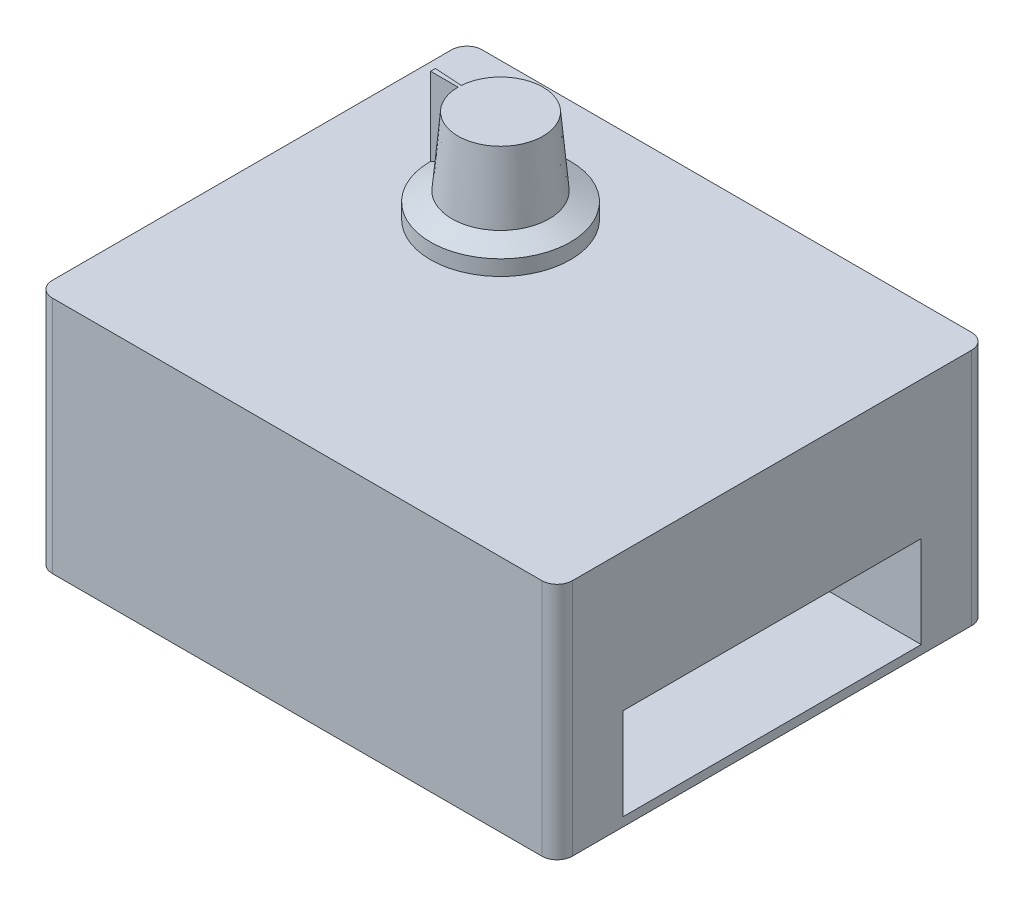
from build123d import *

# Parameters (mm, degrees)
SKETCH1_W           = 86.36
SKETCH1_H           = 71.374
BOSS_EXTRUDE1_DEPTH = 39.624
FILLET1_R           = 2.54
CUT_EXTRUDE1_DEPTH  = 25.4
FILLET2_R           = 1.27
SKETCH4_W           = 49.53
SKETCH4_H           = 15.24
CUT_EXTRUDE2_DEPTH  = 50.8
SKETCH5_R           = 11.6205
BOSS_EXTRUDE2_DEPTH = 15.494
CUT_REVOLVE1_ANGLE  = 356


with BuildPart() as part:
    # Sketch1 → Boss-Extrude1 (new body)
    with BuildSketch(Plane(origin=(0, 0, 0), x_dir=(1, 0, 0), z_dir=(0, 1, 0))):
        with Locations((43.18, -35.687)):
            Rectangle(SKETCH1_W, SKETCH1_H)
    extrude(amount=BOSS_EXTRUDE1_DEPTH)

    # Fillet1
    fillet1_edges = [part.edges().sort_by_distance(p)[0] for p in [
        (0, 19.812, 0),
        (86.36, 19.812, 0),
        (86.36, 19.812, 71.374),
        (0, 19.812, 71.374),
    ]]
    fillet(fillet1_edges, radius=FILLET1_R)

    # Sketch2 → Cut-Extrude1 (cut)
    with BuildSketch(Plane.ZY):
        with BuildLine():
            Line((30.226, 33.02), (30.48, 33.02))
            ThreePointArc((30.48, 33.02), (31.737235857, 32.499235857), (32.258, 31.242))
            Line((32.258, 31.242), (32.258, 24.892))
            ThreePointArc((32.258, 24.892), (31.737235857, 23.634764143), (30.48, 23.114))
            Line((30.48, 23.114), (30.226, 23.114))
            ThreePointArc((30.226, 23.114), (28.968764143, 23.634764143), (28.448, 24.892))
            Line((28.448, 24.892), (28.448, 31.242))
            ThreePointArc((28.448, 31.242), (28.968764143, 32.499235857), (30.226, 33.02))
        make_face()
        with BuildLine():
            Line((41.148, 23.114), (40.894, 23.114))
            ThreePointArc((40.894, 23.114), (39.636764143, 23.634764143), (39.116, 24.892))
            Line((39.116, 24.892), (39.116, 31.242))
            ThreePointArc((39.116, 31.242), (39.636764143, 32.499235857), (40.894, 33.02))
            Line((40.894, 33.02), (41.148, 33.02))
            ThreePointArc((41.148, 33.02), (42.405235857, 32.499235857), (42.926, 31.242))
            Line((42.926, 31.242), (42.926, 24.892))
            ThreePointArc((42.926, 24.892), (42.405235857, 23.634764143), (41.148, 23.114))
        make_face()
    extrude(amount=-CUT_EXTRUDE1_DEPTH, mode=Mode.SUBTRACT)

    # Fillet2
    fillet2_edges = [part.edges().sort_by_distance(p)[0] for p in [
        (0, 23.634764143, 28.968764143),
        (0, 23.114, 30.353),
        (0, 23.634764143, 31.737235857),
        (0, 28.067, 32.258),
        (0, 32.499235857, 31.737235857),
        (0, 33.02, 30.353),
        (0, 32.499235857, 28.968764143),
        (0, 28.067, 28.448),
        (0, 23.634764143, 42.405235857),
        (0, 28.067, 42.926),
        (0, 32.499235857, 42.405235857),
        (0, 33.02, 41.021),
        (0, 32.499235857, 39.636764143),
        (0, 28.067, 39.116),
        (0, 23.634764143, 39.636764143),
        (0, 23.114, 41.021),
    ]]
    fillet(fillet2_edges, radius=FILLET2_R)

    # Sketch4 → Cut-Extrude2 (cut)
    with BuildSketch(Plane(origin=(86.36, 0, 0), x_dir=(0, 0, -1), z_dir=(1, 0, 0))):
        with Locations((-35.687, 9.0932)):
            Rectangle(SKETCH4_W, SKETCH4_H)
    extrude(amount=-CUT_EXTRUDE2_DEPTH, mode=Mode.SUBTRACT)

    # Sketch5 → Boss-Extrude2 (add)
    with BuildSketch(Plane(origin=(0, 39.624, 0), x_dir=(1, 0, 0), z_dir=(0, 1, 0))):
        with Locations(Location((28.448, -22.86, 0), (0, 0, 270))):
            Circle(SKETCH5_R)
    extrude(amount=BOSS_EXTRUDE2_DEPTH)

    # Sketch7 → Cut-Revolve1 (revolve, cut)
    with BuildSketch(Plane(origin=(0, 0, 22.86), x_dir=(-1, 0, 0), z_dir=(0, 0, -1))):
        Polygon((-16.8275, 42.164), (-20.3835, 43.727171461), (-21.3995, 55.118), (-16.8275, 55.118), align=None)
    revolve(axis=Axis((28.448, 55.118, 22.86), (0, 1, 0)), revolution_arc=CUT_REVOLVE1_ANGLE, mode=Mode.SUBTRACT)


solid = part.part
